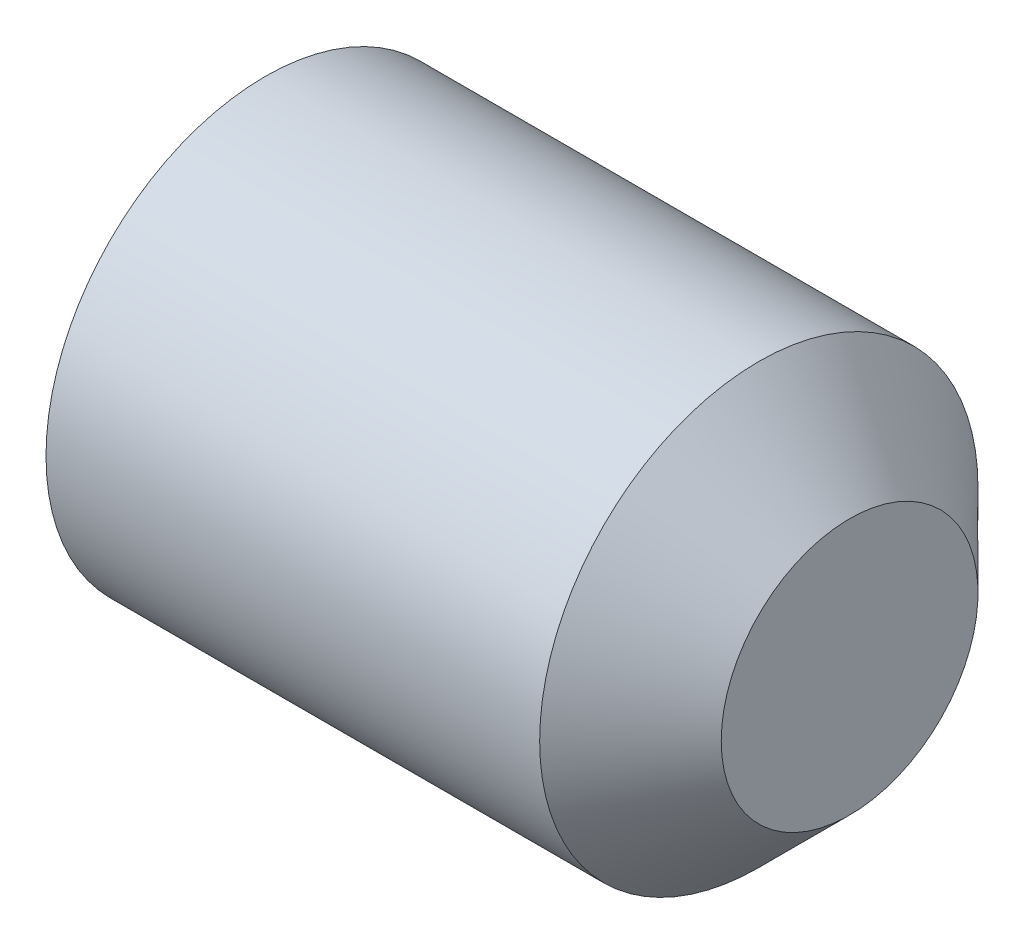
from build123d import *

# Parameters (mm, degrees)
CUT_EXTRUDE1_DEPTH = 1.5


with BuildPart() as part:
    # Sketch1 → Revolve1 (revolve)
    with BuildSketch(Plane.XY, mode=Mode.PRIVATE) as revolve1_sk:
        Polygon((4, 0.878679656), (4, 0), (0, 0), (0, 1.5), (3.378679656, 1.5), align=None)
    revolve(revolve1_sk.sketch.rotate(Axis((0, 0, 0), (1, 0, 0)), 90), axis=Axis((0, 0, 0), (1, 0, 0)))

    # Sketch2 → Cut-Extrude1 (cut)
    with BuildSketch(Plane.ZY):
        Polygon((-0.433012702, 0.75), (-0.866025404, 0), (-0.433012702, -0.75), (0.433012702, -0.75), (0.866025404, 0), (0.433012702, 0.75), align=None)
    extrude(amount=-CUT_EXTRUDE1_DEPTH, mode=Mode.SUBTRACT)


solid = part.part
